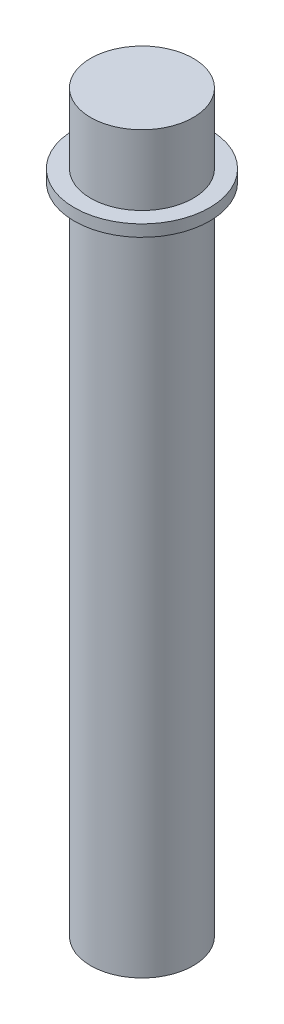
from build123d import *

# Parameters (mm, degrees)
BOSS_EXTRUDE1_DEPTH      = 10
BOSS_EXTRUDE1_DEPTH_BACK = 21.5
SKETCH1_R                = 2.2
SKETCH2_R                = 2.9
SKETCH2_R_2              = 2.2
BOSS_EXTRUDE2_DEPTH      = 0.5


with BuildPart() as part:
    # Sketch1 → Boss-Extrude1 (new, two sides: drawn at the far end of the back side and taken through both)
    with BuildSketch(Plane(origin=(0, 0, 0), x_dir=(1, 0, 0), z_dir=(0, 1, 0)).offset(-BOSS_EXTRUDE1_DEPTH_BACK)):
        with Locations(Location((0, 0, 0), (0, 0, 270))):
            Circle(SKETCH1_R)
    extrude(amount=BOSS_EXTRUDE1_DEPTH + BOSS_EXTRUDE1_DEPTH_BACK)

    # Sketch2 → Boss-Extrude2 (add)
    with BuildSketch(Plane(origin=(0, 7, 0), x_dir=(1, 0, 0), z_dir=(0, 1, 0))):
        with Locations(Location((0, 0, 0), (0, 0, 270))):
            Circle(SKETCH2_R)
        with Locations(Location((0, 0, 0), (0, 0, 270))):
            Circle(SKETCH2_R_2, mode=Mode.SUBTRACT)
    extrude(amount=-BOSS_EXTRUDE2_DEPTH)


solid = part.part
